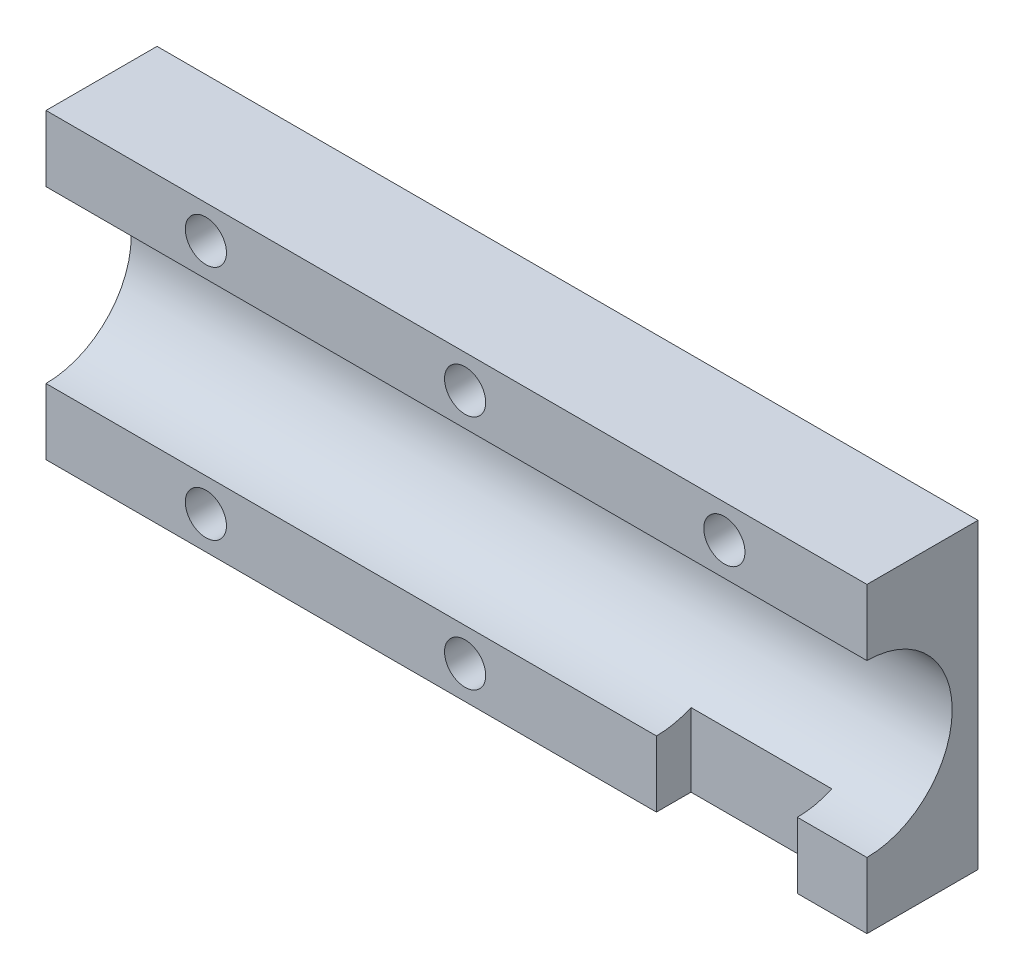
from build123d import *

# Parameters (mm, degrees)
SKETCH1_W                = 118.11
SKETCH1_H                = 44.45
BOSS_EXTRUDE1_DEPTH      = 2
BOSS_EXTRUDE2_DEPTH      = 2.54
BOSS_EXTRUDE2_DEPTH_BACK = 118.11
SKETCH3_R                = 3.025
CUT_EXTRUDE1_DEPTH       = 8
SKETCH11_W               = 20.708368279
SKETCH11_H               = 9.6981
CUT_EXTRUDE4_DEPTH       = 5.08
SKETCH12_W               = 20.708368279
SKETCH12_H               = 5.08
CUT_EXTRUDE5_DEPTH       = 2.54
LPATTERN1_COUNT          = 2
LPATTERN1_PITCH          = 38.1
MIRROR1_COPY_1_SKETCH_R  = 3.025
MIRROR1_COPY_1_DEPTH     = 8
LPATTERN2_COUNT          = 2
LPATTERN2_PITCH          = 38.1
SKETCH16_W               = 2
SKETCH16_H               = 44.45
BOSS_EXTRUDE5_DEPTH      = 2.54


with BuildPart() as part:
    # Sketch1 → Boss-Extrude1 (new body)
    with BuildSketch(Plane.XY):
        Rectangle(SKETCH1_W, SKETCH1_H)
    extrude(amount=BOSS_EXTRUDE1_DEPTH)

    # Sketch2 → Boss-Extrude2 (add, two sides: drawn at the far end of the back side and taken through both)
    with BuildSketch(Plane.ZY.offset(59.055).offset(-BOSS_EXTRUDE2_DEPTH_BACK)):
        with BuildLine():
            Line((16.3195, 22.225), (2, 22.225))
            Line((2, 22.225), (2, -22.225))
            Line((2, -22.225), (16.3195, -22.225))
            Line((16.3195, -22.225), (16.3195, -12.5269))
            ThreePointArc((16.3195, -12.5269), (3.7926, 0), (16.3195, 12.5269))
            Line((16.3195, 12.5269), (16.3195, 22.225))
        make_face()
    extrude(amount=BOSS_EXTRUDE2_DEPTH + BOSS_EXTRUDE2_DEPTH_BACK)

    # Sketch3 → Cut-Extrude1 (cut)
    with BuildSketch(Plane.XY.offset(16.3195)):
        with Locations((0, 17.37595)):
            Circle(SKETCH3_R)
    cut_extrude1 = extrude(amount=-CUT_EXTRUDE1_DEPTH, mode=Mode.SUBTRACT)

    # Sketch11 → Cut-Extrude4 (cut)
    with BuildSketch(Plane.XY.offset(16.3195)):
        with Locations((38.470435787, -17.37595)):
            Rectangle(SKETCH11_W, SKETCH11_H)
    extrude(amount=-CUT_EXTRUDE4_DEPTH, mode=Mode.SUBTRACT)

    # Sketch12 → Cut-Extrude5 (cut)
    with BuildSketch(Plane.XZ.offset(12.5269)):
        with Locations((38.470435787, 13.7795)):
            Rectangle(SKETCH12_W, SKETCH12_H)
    extrude(amount=-CUT_EXTRUDE5_DEPTH, mode=Mode.SUBTRACT)

    # LPattern1: Cut-Extrude1 ×2
    with Locations(*[(-i * LPATTERN1_PITCH, 0, 0) for i in range(1, LPATTERN1_COUNT)]):
        add(cut_extrude1, mode=Mode.SUBTRACT)

    # Mirror1: Cut-Extrude1 across plane
    add(cut_extrude1.mirror(Plane.ZX), mode=Mode.SUBTRACT)

    # Mirror1 copy 1 sketch → Mirror1 copy 1 (cut)
    with BuildSketch(Plane(origin=(-38.1, 0, 16.3195), x_dir=(1, 0, 0), z_dir=(0, 0, 1))):
        with Locations((0, -17.37595)):
            Circle(MIRROR1_COPY_1_SKETCH_R)
    extrude(amount=-MIRROR1_COPY_1_DEPTH, mode=Mode.SUBTRACT)

    # LPattern2: Cut-Extrude1 ×2
    with Locations(*[(i * LPATTERN2_PITCH, 0, 0) for i in range(1, LPATTERN2_COUNT)]):
        add(cut_extrude1, mode=Mode.SUBTRACT)

    # Sketch16 → Boss-Extrude5 (add)
    with BuildSketch(Plane.ZY.offset(59.055)):
        with Locations((1, 0)):
            Rectangle(SKETCH16_W, SKETCH16_H)
    extrude(amount=BOSS_EXTRUDE5_DEPTH)


solid = part.part
